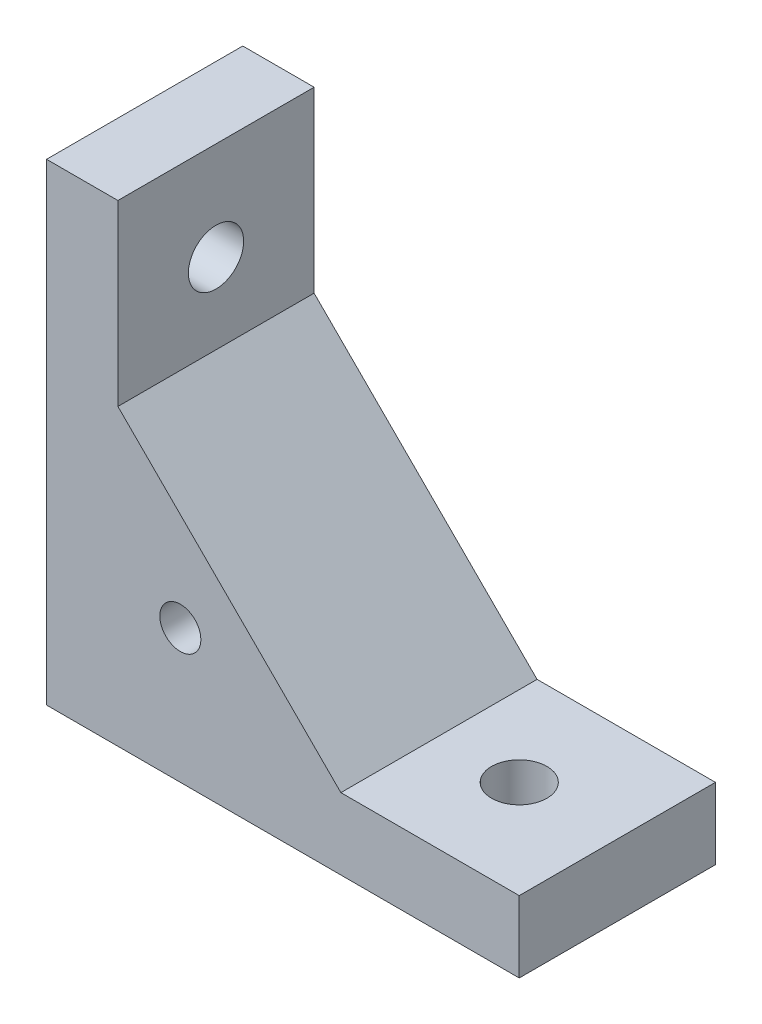
from build123d import *

# Parameters (mm, degrees)
SKETCH_1_R              = 2.3
EXTRUDE_1_DEPTH         = 11
HOLE_WIZARD_6_2_6_2_1_D = 6.2
HOLE_WIZARD_6_2_6_2_2_D = 6.2


with BuildPart() as part:
    # 草图1 → 凸台-拉伸1 (new, symmetric)
    with BuildSketch(Plane.XY):
        Polygon((0, 0), (0, 53), (8, 53), (8, 33), (33, 8), (53, 8), (53, 0), align=None)
        with Locations((15, 15)):
            Circle(SKETCH_1_R, mode=Mode.SUBTRACT)
    extrude(amount=EXTRUDE_1_DEPTH, both=True)

    # Ø6.2 (6.2) 直径孔1 (through all)
    with Locations(Plane(origin=(0, 8, 0), x_dir=(1, 0, 0), z_dir=(0, 1, 0))):
        with Locations((42, 0)):
            Hole(HOLE_WIZARD_6_2_6_2_1_D / 2)

    # Ø6.2 (6.2) 直径孔2 (through all)
    with Locations(Plane(origin=(8, 0, 0), x_dir=(0, 0, -1), z_dir=(1, 0, 0))):
        with Locations((0, 42)):
            Hole(HOLE_WIZARD_6_2_6_2_2_D / 2)


solid = part.part
